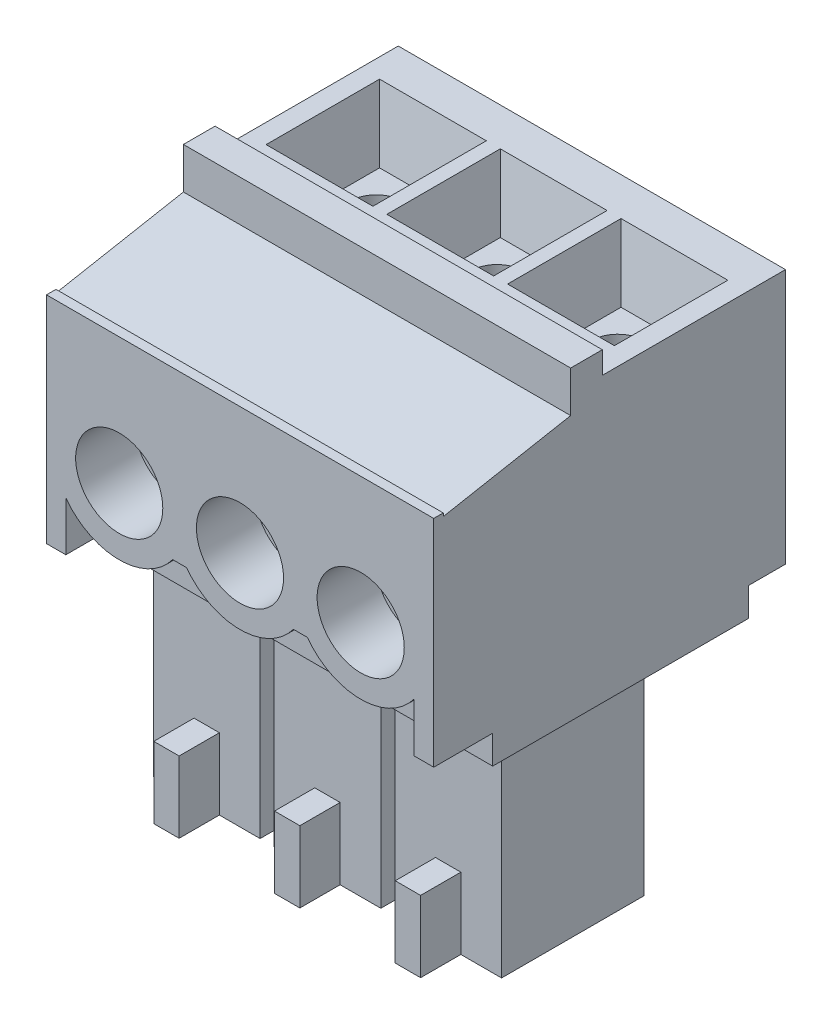
from build123d import *

# Parameters (mm, degrees)
SKETCH1_W                 = 12.22
SKETCH1_H                 = 11.1
BOSS_EXTRUDE1_DEPTH       = 9.65
SKETCH2_W                 = 5.78
SKETCH2_H                 = 0.7
CUT_EXTRUDE1_DEPTH        = 17.530378096
SKETCH4_W                 = 1.86
SKETCH4_H                 = 0.9
SKETCH4_W_2               = 1.16
CUT_EXTRUDE3_DEPTH        = 17.530378096
SKETCH5_W                 = 10.98
SKETCH5_H                 = 7.18
CUT_EXTRUDE4_DEPTH        = 0.9
SKETCH6_W                 = 3.37
SKETCH6_H                 = 7.18
BOSS_EXTRUDE2_DEPTH       = 7.45
SKETCH7_W                 = 0.8
SKETCH7_H                 = 1.27
BOSS_EXTRUDE3_DEPTH       = 2.25
SKETCH8_R                 = 0.601040764
CUT_EXTRUDE5_DEPTH        = 6.55
FILLET1_R                 = 0.2
SKETCH9_R                 = 1.375
CUT_EXTRUDE6_DEPTH        = 1.86
SKETCH11_W                = 3.37
SKETCH11_H                = 3.58
CUT_EXTRUDE8_DEPTH        = 2
CUT_EXTRUDE8_DRAFT        = -12
SKETCH12_R                = 0.815
CUT_EXTRUDE9_DEPTH        = 4.8
LPATTERN1_COUNT           = 3
LPATTERN1_PITCH           = 3.81
LPATTERN1_COPY_1_SKETCH_W = 3.37
LPATTERN1_COPY_1_SKETCH_H = 3.58
LPATTERN1_COPY_1_DEPTH    = 2
LPATTERN1_COPY_1_DRAFT    = -12
LPATTERN1_COPY_2_SKETCH_W = 3.37
LPATTERN1_COPY_2_SKETCH_H = 3.58
LPATTERN1_COPY_2_DEPTH    = 2
LPATTERN1_COPY_2_DRAFT    = -12
FILLET1_OF_LPATTERN1_R    = 0.2
SKETCH10_W                = 0.44
SKETCH10_H                = 1.555090365
CUT_EXTRUDE7_DEPTH        = 1.86
LPATTERN2_COUNT           = 2
LPATTERN2_PITCH           = 3.81


with BuildPart() as part:
    # Sketch1 → Boss-Extrude1 (new body)
    with BuildSketch(Plane(origin=(0, 0, 0), x_dir=(1, 0, 0), z_dir=(0, 1, 0))):
        Rectangle(SKETCH1_W, SKETCH1_H)
    extrude(amount=BOSS_EXTRUDE1_DEPTH)

    # Sketch2 → Cut-Extrude1 (cut, through all)
    with BuildSketch(Plane(origin=(6.11, 0, 0), x_dir=(0, 0, -1), z_dir=(1, 0, 0))):
        Polygon((-1.23, 9.65), (-1.23, 8.35), (-5.25, 7.6), (-5.25, 7.7), (-5.55, 7.7), (-5.55, 9.65), align=None)
        with Locations((2.66, 9.3)):
            Rectangle(SKETCH2_W, SKETCH2_H)
    extrude(amount=-CUT_EXTRUDE1_DEPTH, mode=Mode.SUBTRACT)

    # Sketch4 → Cut-Extrude3 (cut, through all)
    with BuildSketch(Plane(origin=(6.11, 0, 0), x_dir=(0, 0, -1), z_dir=(1, 0, 0))):
        with Locations((-4.62, 0.45)):
            Rectangle(SKETCH4_W, SKETCH4_H)
        with Locations((4.97, 0.45)):
            Rectangle(SKETCH4_W_2, SKETCH4_H)
    extrude(amount=-CUT_EXTRUDE3_DEPTH, mode=Mode.SUBTRACT)

    # Sketch5 → Cut-Extrude4 (cut)
    with BuildSketch(Plane.XZ):
        with Locations((0, -0.8)):
            Rectangle(SKETCH5_W, SKETCH5_H)
    extrude(amount=-CUT_EXTRUDE4_DEPTH, mode=Mode.SUBTRACT)

    # Sketch6 → Boss-Extrude2 (add)
    with BuildSketch(Plane.XZ.offset(-0.9)):
        with Locations((3.805, -0.8)):
            Rectangle(SKETCH6_W, SKETCH6_H)
    boss_extrude2 = extrude(amount=BOSS_EXTRUDE2_DEPTH)

    # Sketch7 → Boss-Extrude3 (add)
    with BuildSketch(Plane.XZ.offset(6.55)):
        with Locations((3.805, 3.425)):
            Rectangle(SKETCH7_W, SKETCH7_H)
    boss_extrude3 = extrude(amount=-BOSS_EXTRUDE3_DEPTH)

    # Sketch8 → Cut-Extrude5 (cut)
    with BuildSketch(Plane.XZ.offset(6.55)):
        with Locations(Location((3.805, 0.545, 0), (0, 0, 270))):
            Circle(SKETCH8_R)
        with BuildLine():
            Line((2.12, -1.7), (2.905, -1.7))
            ThreePointArc((2.905, -1.7), (3.805, -1.34), (4.705, -1.7))
            Line((4.705, -1.7), (5.49, -1.7))
            Line((5.49, -1.7), (5.49, -4.39))
            Line((5.49, -4.39), (2.12, -4.39))
            Line((2.12, -4.39), (2.12, -1.7))
        make_face()
    cut_extrude5 = extrude(amount=-CUT_EXTRUDE5_DEPTH, mode=Mode.SUBTRACT)

    # Fillet1
    fillet1_edges = [part.edges().sort_by_distance(p)[0] for p in [
        (3.805, -6.55, 1.146040764),
    ]]
    fillet(fillet1_edges, radius=FILLET1_R)

    # Sketch9 → Cut-Extrude6 (cut)
    with BuildSketch(Plane.XY.offset(5.55)):
        with Locations((3.805, 3.7)):
            Circle(SKETCH9_R)
        with BuildLine():
            Line((2.12, 2.455090365), (2.12, 0.9))
            Line((2.12, 0.9), (5.49, 0.9))
            Line((5.49, 0.9), (5.49, 2.455090365))
            ThreePointArc((5.49, 2.455090365), (3.805, 1.605), (2.12, 2.455090365))
        make_face()
    cut_extrude6 = extrude(amount=-CUT_EXTRUDE6_DEPTH, mode=Mode.SUBTRACT)


with BuildPart() as cut_extrude8_tool:
    # Sketch11 → Cut-Extrude8 (with draft: the straight prism first)
    with BuildSketch(Plane(origin=(0, 8.95, 0), x_dir=(1, 0, 0), z_dir=(0, 1, 0))):
        with Locations((3.805, 2.56)):
            Rectangle(SKETCH11_W, SKETCH11_H)
    extrude(amount=-CUT_EXTRUDE8_DEPTH)
    # Cut-Extrude8: the draft: its side faces are tilted about the plane it starts from
    cut_extrude8_sides = [cut_extrude8_tool.faces().sort_by_distance(p)[0] for p in [
        (5.49, 7.95, -2.56),
        (3.805, 7.95, -4.35),
        (2.12, 7.95, -2.56),
        (3.805, 7.95, -0.77),
    ]]
    draft(cut_extrude8_sides, Plane(origin=(0, 8.95, 0), x_dir=(1, 0, 0), z_dir=(0, 1, 0)), CUT_EXTRUDE8_DRAFT)


with BuildPart() as part_1:
    add(part.part)

    # Cut-Extrude8: cut by cut_extrude8_tool
    add(cut_extrude8_tool.part, mode=Mode.SUBTRACT)

    # Sketch12 → Cut-Extrude9 (cut)
    with BuildSketch(Plane(origin=(0, 6.95, 0), x_dir=(1, 0, 0), z_dir=(0, 1, 0))):
        with Locations(Location((3.805, 2.56, 0), (0, 0, 270))):
            Circle(SKETCH12_R)
    cut_extrude9 = extrude(amount=-CUT_EXTRUDE9_DEPTH, mode=Mode.SUBTRACT)

    # LPattern1: Boss-Extrude2, Boss-Extrude3, Cut-Extrude5, Cut-Extrude6, Cut-Extrude9 ×3
    with Locations(*[(-i * LPATTERN1_PITCH, 0, 0) for i in range(1, LPATTERN1_COUNT)]):
        add(boss_extrude2)
        add(boss_extrude3)
        add(cut_extrude5, mode=Mode.SUBTRACT)
        add(cut_extrude6, mode=Mode.SUBTRACT)
        add(cut_extrude9, mode=Mode.SUBTRACT)


with BuildPart() as lpattern1_copy_1_tool:
    # LPattern1 copy 1 sketch → LPattern1 copy 1 (with draft: the straight prism first)
    with BuildSketch(Plane(origin=(-3.81, 8.95, 0), x_dir=(1, 0, 0), z_dir=(0, 1, 0))):
        with Locations((3.805, 2.56)):
            Rectangle(LPATTERN1_COPY_1_SKETCH_W, LPATTERN1_COPY_1_SKETCH_H)
    extrude(amount=-LPATTERN1_COPY_1_DEPTH)
    # LPattern1 copy 1: the draft: its side faces are tilted about the plane it starts from
    lpattern1_copy_1_sides = [lpattern1_copy_1_tool.faces().sort_by_distance(p)[0] for p in [
        (1.68, 7.95, -2.56),
        (-0.005, 7.95, -4.35),
        (-1.69, 7.95, -2.56),
        (-0.005, 7.95, -0.77),
    ]]
    draft(lpattern1_copy_1_sides, Plane(origin=(-3.81, 8.95, 0), x_dir=(1, 0, 0), z_dir=(0, 1, 0)), LPATTERN1_COPY_1_DRAFT)


with BuildPart() as part_2:
    add(part_1.part)

    # LPattern1 copy 1: cut by lpattern1_copy_1_tool
    add(lpattern1_copy_1_tool.part, mode=Mode.SUBTRACT)


with BuildPart() as lpattern1_copy_2_tool:
    # LPattern1 copy 2 sketch → LPattern1 copy 2 (with draft: the straight prism first)
    with BuildSketch(Plane(origin=(-7.62, 8.95, 0), x_dir=(1, 0, 0), z_dir=(0, 1, 0))):
        with Locations((3.805, 2.56)):
            Rectangle(LPATTERN1_COPY_2_SKETCH_W, LPATTERN1_COPY_2_SKETCH_H)
    extrude(amount=-LPATTERN1_COPY_2_DEPTH)
    # LPattern1 copy 2: the draft: its side faces are tilted about the plane it starts from
    lpattern1_copy_2_sides = [lpattern1_copy_2_tool.faces().sort_by_distance(p)[0] for p in [
        (-2.13, 7.95, -2.56),
        (-3.815, 7.95, -4.35),
        (-5.5, 7.95, -2.56),
        (-3.815, 7.95, -0.77),
    ]]
    draft(lpattern1_copy_2_sides, Plane(origin=(-7.62, 8.95, 0), x_dir=(1, 0, 0), z_dir=(0, 1, 0)), LPATTERN1_COPY_2_DRAFT)


with BuildPart() as part_3:
    add(part_2.part)

    # LPattern1 copy 2: cut by lpattern1_copy_2_tool
    add(lpattern1_copy_2_tool.part, mode=Mode.SUBTRACT)

    # Fillet1 of LPattern1
    fillet1_of_lpattern1_edges = [part_3.edges().sort_by_distance(p)[0] for p in [
        (-0.005, -6.55, 1.146040764),
        (-3.815, -6.55, 1.146040764),
    ]]
    fillet(fillet1_of_lpattern1_edges, radius=FILLET1_OF_LPATTERN1_R)

    # Sketch10 → Cut-Extrude7 (cut)
    with BuildSketch(Plane.XY.offset(5.55)):
        with Locations((1.9, 1.677545183)):
            Rectangle(SKETCH10_W, SKETCH10_H)
    cut_extrude7 = extrude(amount=-CUT_EXTRUDE7_DEPTH, mode=Mode.SUBTRACT)

    # LPattern2: Cut-Extrude7 ×2
    with Locations(*[(-i * LPATTERN2_PITCH, 0, 0) for i in range(1, LPATTERN2_COUNT)]):
        add(cut_extrude7, mode=Mode.SUBTRACT)


solid = part_3.part
